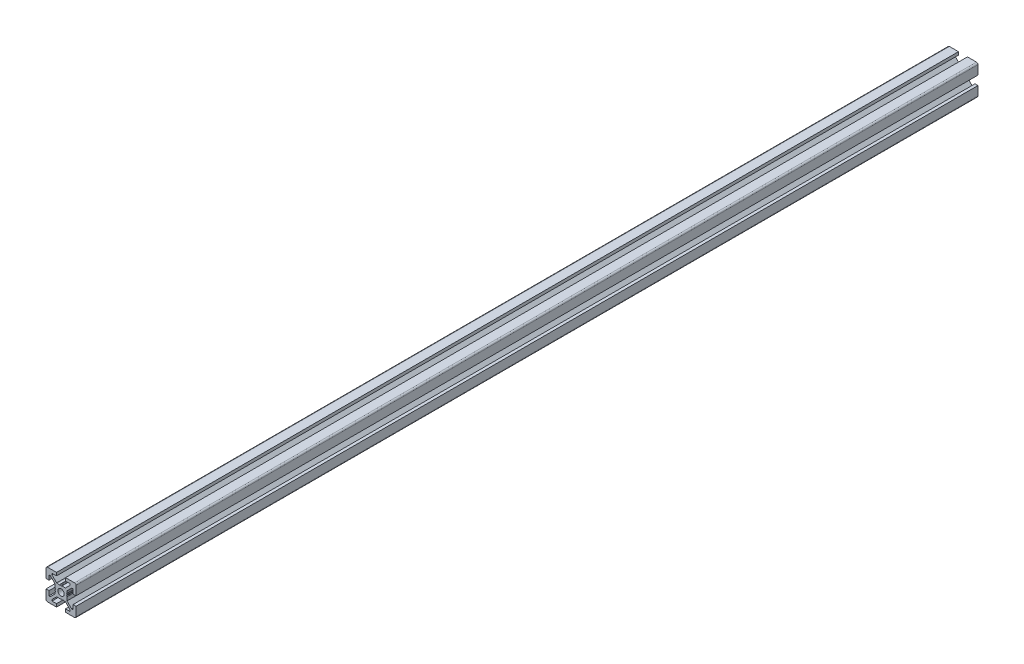
from build123d import *

# Parameters (mm, degrees)
SKETCH1_R           = 2.1
BOSS_EXTRUDE1_DEPTH = 600


with BuildPart() as part:
    # Sketch1 → Boss-Extrude1 (new body)
    with BuildSketch(Plane(origin=(0, 0, -2000), x_dir=(-1, 0, 0), z_dir=(0, 0, -1))):
        with BuildLine():
            Line((10, -3), (8, -3))
            Line((8, -3), (8, -6))
            Line((8, -6), (7.060660172, -6))
            Line((7.060660172, -6), (4, -2.939339828))
            Line((4, -2.939339828), (4, -2.5))
            Line((4, -2.5), (3.750976592, -1.218885629))
            Line((3.750976592, -1.218885629), (3.933012702, -0.903589838))
            ThreePointArc((3.933012702, -0.903589838), (4, -0.653589838), (3.933012702, -0.403589838))
            Line((3.933012702, -0.403589838), (3.7, 0))
            Line((3.7, 0), (3.933012702, 0.403589838))
            ThreePointArc((3.933012702, 0.403589838), (3.982962913, 0.524180316), (4, 0.653589838))
            Line((4, 0.653589838), (4, 2.939339828))
            Line((4, 2.939339828), (7.060660172, 6))
            Line((7.060660172, 6), (8, 6))
            Line((8, 6), (8, 3))
            Line((8, 3), (10, 3))
            Line((10, 3), (10, 9))
            ThreePointArc((10, 9), (9.707106781, 9.707106781), (9, 10))
            Line((9, 10), (3, 10))
            Line((3, 10), (3, 8))
            Line((3, 8), (6, 8))
            Line((6, 8), (6, 7.060660172))
            Line((6, 7.060660172), (2.939339828, 4))
            Line((2.939339828, 4), (2.5, 4))
            Line((2.5, 4), (1.218885629, 3.750976592))
            Line((1.218885629, 3.750976592), (0.903589838, 3.933012702))
            ThreePointArc((0.903589838, 3.933012702), (0.653589838, 4), (0.403589838, 3.933012702))
            Line((0.403589838, 3.933012702), (0, 3.7))
            Line((0, 3.7), (-0.403589838, 3.933012702))
            ThreePointArc((-0.403589838, 3.933012702), (-0.524180316, 3.982962913), (-0.653589838, 4))
            Line((-0.653589838, 4), (-2.939339828, 4))
            Line((-2.939339828, 4), (-6, 7.060660172))
            Line((-6, 7.060660172), (-6, 8))
            Line((-6, 8), (-3, 8))
            Line((-3, 8), (-3, 10))
            Line((-3, 10), (-9, 10))
            ThreePointArc((-9, 10), (-9.707106781, 9.707106781), (-10, 9))
            Line((-10, 9), (-10, 3))
            Line((-10, 3), (-8, 3))
            Line((-8, 3), (-8, 6))
            Line((-8, 6), (-7.060660172, 6))
            Line((-7.060660172, 6), (-4, 2.939339828))
            Line((-4, 2.939339828), (-4, 2.5))
            Line((-4, 2.5), (-3.750976592, 1.218885629))
            Line((-3.750976592, 1.218885629), (-3.933012702, 0.903589838))
            ThreePointArc((-3.933012702, 0.903589838), (-4, 0.653589838), (-3.933012702, 0.403589838))
            Line((-3.933012702, 0.403589838), (-3.7, 0))
            Line((-3.7, 0), (-3.933012702, -0.403589838))
            ThreePointArc((-3.933012702, -0.403589838), (-3.982962913, -0.524180316), (-4, -0.653589838))
            Line((-4, -0.653589838), (-4, -2.939339828))
            Line((-4, -2.939339828), (-7.060660172, -6))
            Line((-7.060660172, -6), (-8, -6))
            Line((-8, -6), (-8, -3))
            Line((-8, -3), (-10, -3))
            Line((-10, -3), (-10, -9))
            ThreePointArc((-10, -9), (-9.707106781, -9.707106781), (-9, -10))
            Line((-9, -10), (-3, -10))
            Line((-3, -10), (-3, -8))
            Line((-3, -8), (-6, -8))
            Line((-6, -8), (-6, -7.060660172))
            Line((-6, -7.060660172), (-2.939339828, -4))
            Line((-2.939339828, -4), (-2.5, -4))
            Line((-2.5, -4), (-1.218885629, -3.750976592))
            Line((-1.218885629, -3.750976592), (-0.903589838, -3.933012702))
            ThreePointArc((-0.903589838, -3.933012702), (-0.653589838, -4), (-0.403589838, -3.933012702))
            Line((-0.403589838, -3.933012702), (0, -3.7))
            Line((0, -3.7), (0.403589838, -3.933012702))
            ThreePointArc((0.403589838, -3.933012702), (0.524180316, -3.982962913), (0.653589838, -4))
            Line((0.653589838, -4), (2.939339828, -4))
            Line((2.939339828, -4), (6, -7.060660172))
            Line((6, -7.060660172), (6, -8))
            Line((6, -8), (3, -8))
            Line((3, -8), (3, -10))
            Line((3, -10), (9, -10))
            ThreePointArc((9, -10), (9.707106781, -9.707106781), (10, -9))
            Line((10, -9), (10, -3))
        make_face()
        with Locations(Location((0, 0, 0), (0, 0, 180))):
            Circle(SKETCH1_R, mode=Mode.SUBTRACT)
    extrude(amount=-BOSS_EXTRUDE1_DEPTH)


solid = part.part
